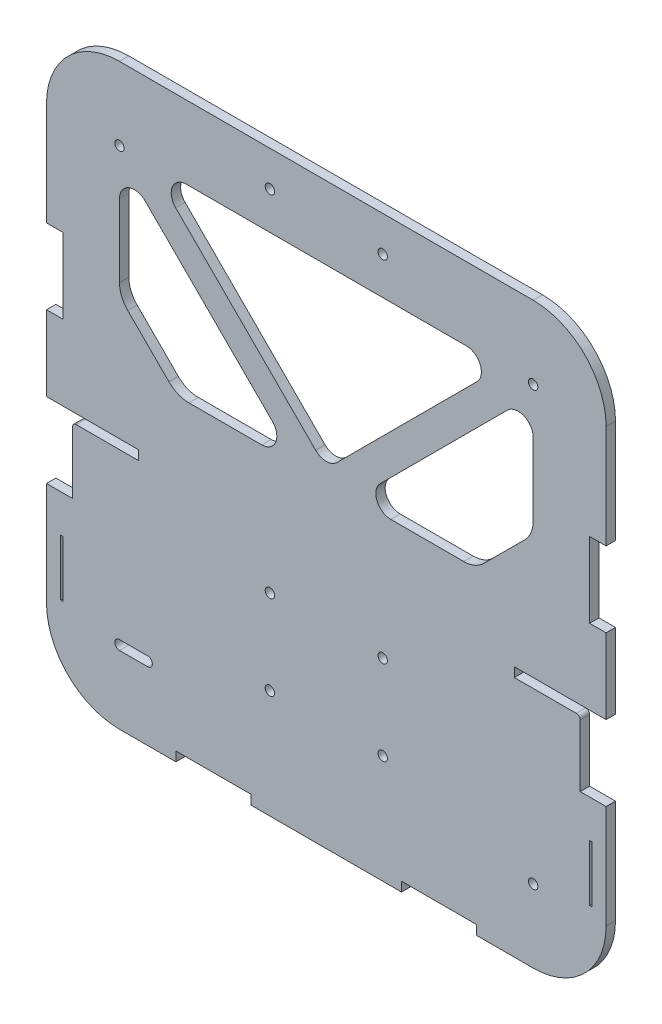
from build123d import *

# Parameters (mm, degrees)
SKETCH1_W           = 0.79375
SKETCH1_H           = 19.05
SKETCH1_R           = 1.5875
BOSS_EXTRUDE1_DEPTH = 3.175


with BuildPart() as part:
    # Sketch1 → Boss-Extrude1 (new body)
    with BuildSketch(Plane.XY.offset(-196.85)):
        with BuildLine():
            Line((-85.725, -136.525), (-94.488, -136.525))
            Line((-94.488, -136.525), (-94.488, -171.45))
            ThreePointArc((-94.488, -171.45), (-87.271696875, -188.871696875), (-69.85, -196.088))
            Line((-69.85, -196.088), (-50.8, -196.088))
            Line((-50.8, -196.088), (-50.8, -192.913))
            Line((-50.8, -192.913), (-25.4, -192.913))
            Line((-25.4, -192.913), (-25.4, -196.088))
            Line((-25.4, -196.088), (25.4, -196.088))
            Line((25.4, -196.088), (25.4, -192.913))
            Line((25.4, -192.913), (50.8, -192.913))
            Line((50.8, -192.913), (50.8, -196.088))
            Line((50.8, -196.088), (69.85, -196.088))
            ThreePointArc((69.85, -196.088), (87.271696875, -188.871696875), (94.488, -171.45))
            Line((94.488, -171.45), (94.488, -136.525))
            Line((94.488, -136.525), (85.725, -136.525))
            Line((85.725, -136.525), (85.725, -115.57))
            ThreePointArc((85.725, -115.57), (85.353025612, -114.671974388), (84.455, -114.3))
            Line((84.455, -114.3), (63.5, -114.3))
            Line((63.5, -114.3), (63.5, -111.125))
            Line((63.5, -111.125), (94.488, -111.125))
            Line((94.488, -111.125), (94.488, -85.725))
            Line((94.488, -85.725), (88.9, -85.725))
            Line((88.9, -85.725), (88.9, -60.325))
            Line((88.9, -60.325), (94.488, -60.325))
            Line((94.488, -60.325), (94.488, -25.4))
            ThreePointArc((94.488, -25.4), (87.271696875, -7.978303125), (69.85, -0.762))
            Line((69.85, -0.762), (-69.85, -0.762))
            ThreePointArc((-69.85, -0.762), (-87.271696875, -7.978303125), (-94.488, -25.4))
            Line((-94.488, -25.4), (-94.488, -60.325))
            Line((-94.488, -60.325), (-88.9, -60.325))
            Line((-88.9, -60.325), (-88.9, -85.725))
            Line((-88.9, -85.725), (-94.488, -85.725))
            Line((-94.488, -85.725), (-94.488, -111.125))
            Line((-94.488, -111.125), (-63.5, -111.125))
            Line((-63.5, -111.125), (-63.5, -114.3))
            Line((-63.5, -114.3), (-84.455, -114.3))
            ThreePointArc((-84.455, -114.3), (-85.353025612, -114.671974388), (-85.725, -115.57))
            Line((-85.725, -115.57), (-85.725, -136.525))
        make_face()
        with Locations((-89.296875, -158.75)):
            Rectangle(SKETCH1_W, SKETCH1_H, mode=Mode.SUBTRACT)
        with BuildLine():
            ThreePointArc((-69.85, -173.0375), (-71.4375, -171.45), (-69.85, -169.8625))
            Line((-69.85, -169.8625), (-60.325, -169.8625))
            ThreePointArc((-60.325, -169.8625), (-58.7375, -171.45), (-60.325, -173.0375))
            Line((-60.325, -173.0375), (-69.85, -173.0375))
        make_face(mode=Mode.SUBTRACT)
        with Locations((-19.05, -159.40600326)):
            Circle(SKETCH1_R, mode=Mode.SUBTRACT)
        with Locations((-19.05, -130.83100326)):
            Circle(SKETCH1_R, mode=Mode.SUBTRACT)
        with Locations((19.05, -159.40600326)):
            Circle(SKETCH1_R, mode=Mode.SUBTRACT)
        with Locations((69.85, -171.45)):
            Circle(SKETCH1_R, mode=Mode.SUBTRACT)
        with Locations((89.296875, -158.75)):
            Rectangle(SKETCH1_W, SKETCH1_H, mode=Mode.SUBTRACT)
        with Locations((19.05, -130.83100326)):
            Circle(SKETCH1_R, mode=Mode.SUBTRACT)
        with BuildLine():
            ThreePointArc((-67.060192091, -72.204012806), (-69.124952547, -69.113880409), (-69.85, -65.468820715))
            Line((-69.85, -65.468820715), (-69.85, -40.839204897))
            ThreePointArc((-69.85, -40.839204897), (-66.714031836, -36.145896872), (-61.177897552, -37.247102448))
            Line((-61.177897552, -37.247102448), (-18.197102448, -80.227897552))
            ThreePointArc((-18.197102448, -80.227897552), (-17.095896872, -85.764031836), (-21.789204897, -88.9))
            Line((-21.789204897, -88.9), (-46.418820715, -88.9))
            ThreePointArc((-46.418820715, -88.9), (-50.063880409, -88.174952547), (-53.154012806, -86.110192091))
            Line((-53.154012806, -86.110192091), (-67.060192091, -72.204012806))
        make_face(mode=Mode.SUBTRACT)
        with Locations((-69.85, -25.4)):
            Circle(SKETCH1_R, mode=Mode.SUBTRACT)
        with Locations((-19.05, -12.7)):
            Circle(SKETCH1_R, mode=Mode.SUBTRACT)
        with BuildLine():
            ThreePointArc((3.592102448, -81.36251337), (0, -82.850410922), (-3.592102448, -81.36251337))
            Line((-3.592102448, -81.36251337), (-50.88251337, -34.072102448))
            ThreePointArc((-50.88251337, -34.072102448), (-51.983718947, -28.535968164), (-47.290410922, -25.4))
            Line((-47.290410922, -25.4), (47.290410922, -25.4))
            ThreePointArc((47.290410922, -25.4), (51.983718947, -28.535968164), (50.88251337, -34.072102448))
            Line((50.88251337, -34.072102448), (3.592102448, -81.36251337))
        make_face(mode=Mode.SUBTRACT)
        with BuildLine():
            ThreePointArc((53.154012806, -86.110192091), (50.063880409, -88.174952547), (46.418820715, -88.9))
            Line((46.418820715, -88.9), (21.789204897, -88.9))
            ThreePointArc((21.789204897, -88.9), (17.095896872, -85.764031836), (18.197102448, -80.227897552))
            Line((18.197102448, -80.227897552), (61.177897552, -37.247102448))
            ThreePointArc((61.177897552, -37.247102448), (66.714031836, -36.145896872), (69.85, -40.839204897))
            Line((69.85, -40.839204897), (69.85, -65.468820715))
            ThreePointArc((69.85, -65.468820715), (69.124952547, -69.113880409), (67.060192091, -72.204012806))
            Line((67.060192091, -72.204012806), (53.154012806, -86.110192091))
        make_face(mode=Mode.SUBTRACT)
        with Locations((19.05, -12.7)):
            Circle(SKETCH1_R, mode=Mode.SUBTRACT)
        with Locations((69.85, -25.4)):
            Circle(SKETCH1_R, mode=Mode.SUBTRACT)
    extrude(amount=-BOSS_EXTRUDE1_DEPTH)


solid = part.part
